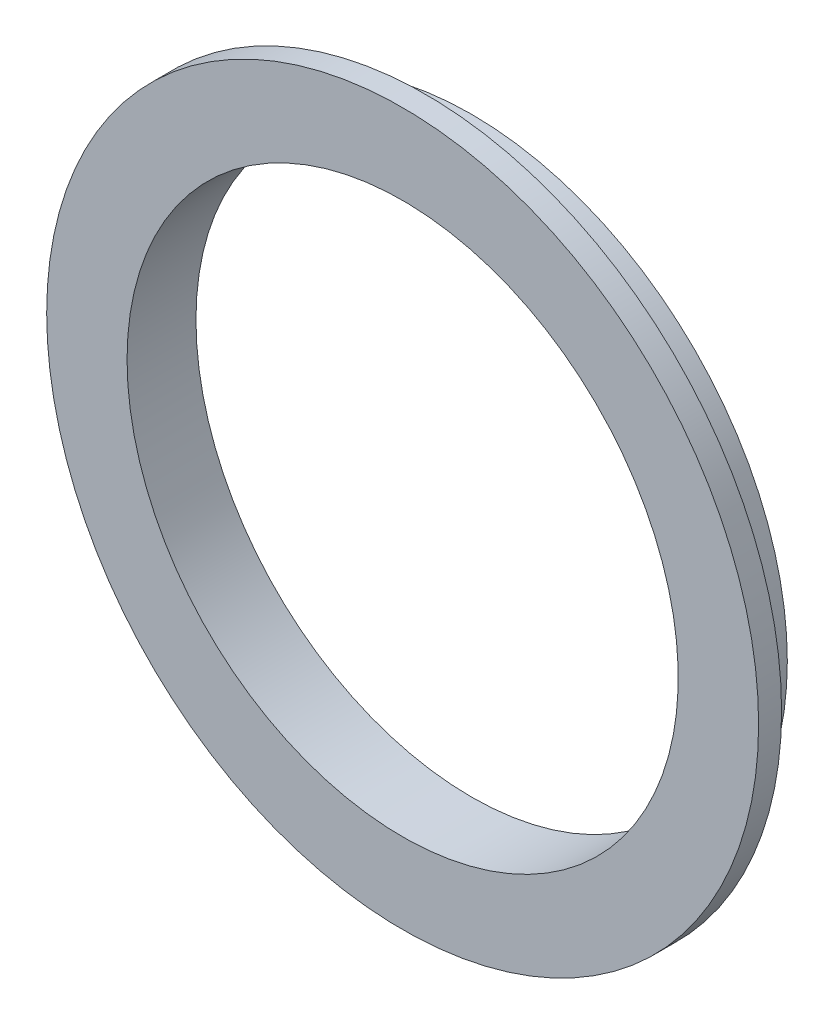
from build123d import *

# Parameters (mm, degrees)
SKETCH_1_R          = 27.5
SKETCH_1_R_2        = 24
EXTRUDE_1_DEPTH     = 4
SKETCH_2_R          = 31
EXTRUDE_2_DEPTH     = 2
SKETCH_3_R          = 24
CUT_EXTRUDE_1_DEPTH = 2


with BuildPart() as part:
    # 草图1 → 凸台-拉伸1 (new body)
    with BuildSketch(Plane.XY):
        Circle(SKETCH_1_R)
        Circle(SKETCH_1_R_2, mode=Mode.SUBTRACT)
    extrude(amount=EXTRUDE_1_DEPTH)

    # 草图2 → 凸台-拉伸2 (add)
    with BuildSketch(Plane.XY.offset(4)):
        Circle(SKETCH_2_R)
    extrude(amount=EXTRUDE_2_DEPTH)

    # 草图3 → 切除-拉伸1 (cut)
    with BuildSketch(Plane(origin=(0, 0, 4), x_dir=(-1, 0, 0), z_dir=(0, 0, -1))):
        Circle(SKETCH_3_R)
    extrude(amount=-CUT_EXTRUDE_1_DEPTH, mode=Mode.SUBTRACT)


solid = part.part
